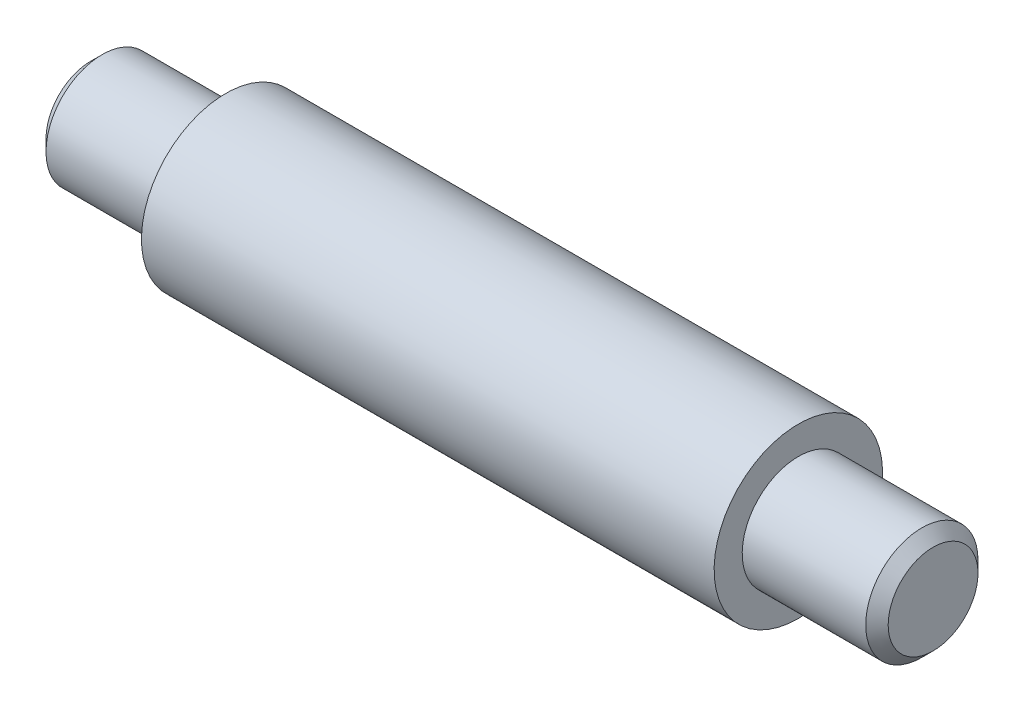
from build123d import *

# Parameters (mm, degrees)
CHAMFER1_SIZE = 2


with BuildPart() as part:
    # Sketch1 → Revolve1 (revolve)
    with BuildSketch(Plane.XY):
        Polygon((-84.357122968, 0), (-60.357122968, 0), (-60.357122968, -5), (41.642877032, -5), (41.642877032, 0), (65.642877032, 0), (65.642877032, 10), (-84.357122968, 10), align=None)
    revolve(axis=Axis((65.642877032, 10, 0), (-1, 0, 0)))

    # Chamfer1
    chamfer1_edges = [part.edges().sort_by_distance(p)[0] for p in [
        (65.642877032, 20, 0),
        (-84.357122968, 20, 0),
    ]]
    chamfer(chamfer1_edges, length=CHAMFER1_SIZE)


solid = part.part
